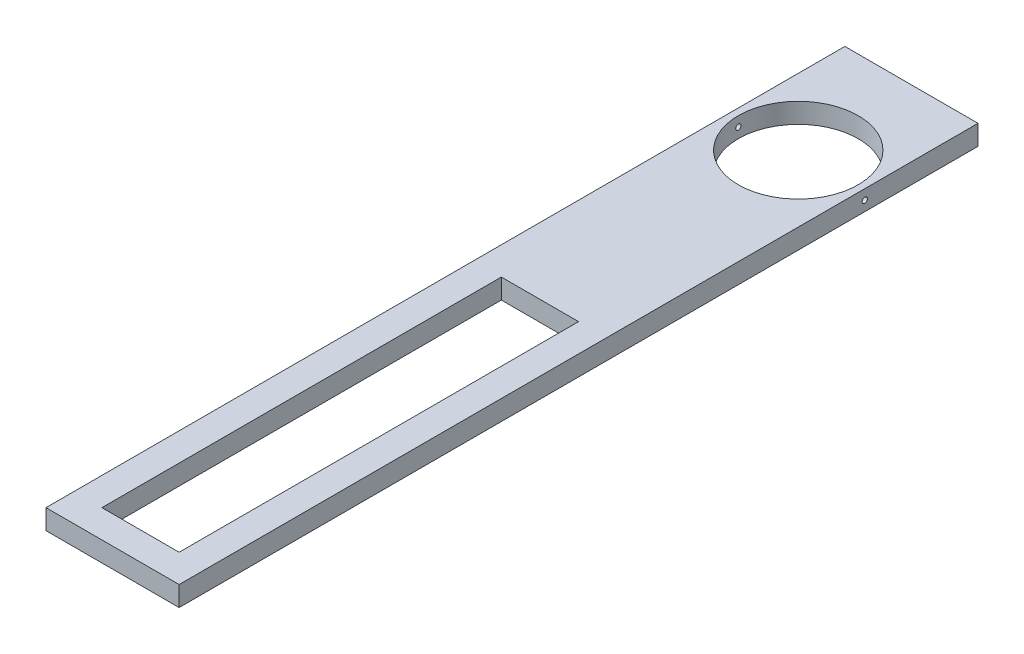
from build123d import *

# Parameters (mm, degrees)
SKETCH1_W               = 100
SKETCH1_H               = 600
BOSS_EXTRUDE2_DEPTH     = 15
SKETCH1_7_W             = 58
SKETCH1_7_H             = 300
CUT_EXTRUDE1_DEPTH      = 65
SKETCH1_8_R             = 45
CUT_EXTRUDE2_DEPTH      = 433.1643206
CUT_EXTRUDE4_DEPTH      = 441.195695118
CUT_EXTRUDE4_DEPTH_BACK = 441.195695118


with BuildPart() as part:
    # Sketch1 → Boss-Extrude2 (new body)
    with BuildSketch(Plane(origin=(0, 0, 0), x_dir=(1, 0, 0), z_dir=(0, 1, 0))):
        with Locations((0, 129)):
            Rectangle(SKETCH1_W, SKETCH1_H)
    extrude(amount=-BOSS_EXTRUDE2_DEPTH)

    # Sketch1<7> → Cut-Extrude1 (cut)
    with BuildSketch(Plane(origin=(0, 0, 0), x_dir=(1, 0, 0), z_dir=(0, 1, 0))):
        Rectangle(SKETCH1_7_W, SKETCH1_7_H)
    extrude(amount=-CUT_EXTRUDE1_DEPTH, mode=Mode.SUBTRACT)

    # Sketch1<8> → Cut-Extrude2 (cut, through all)
    with BuildSketch(Plane(origin=(0, 0, 0), x_dir=(1, 0, 0), z_dir=(0, 1, 0))):
        with Locations(Location((0, 344, 0), (0, 0, 270))):
            Circle(SKETCH1_8_R)
    extrude(amount=-CUT_EXTRUDE2_DEPTH, mode=Mode.SUBTRACT)

    # Sketch5 → Cut-Extrude4 (cut, two sides: drawn at the far end of the back side and taken through both)
    with BuildSketch(Plane(origin=(47.5, 0, 0), x_dir=(0, 0, -1), z_dir=(1, 0, 0)).offset(-CUT_EXTRUDE4_DEPTH_BACK)):
        with BuildLine():
            ThreePointArc((346, -7.5), (345.414213562, -6.085786438), (344, -5.5))
            Line((344, -5.5), (344, -9.5))
            ThreePointArc((344, -9.5), (345.414213562, -8.914213562), (346, -7.5))
        make_face()
        with BuildLine():
            Line((344, -9.5), (344, -5.5))
            ThreePointArc((344, -5.5), (342, -7.5), (344, -9.5))
        make_face()
    extrude(amount=CUT_EXTRUDE4_DEPTH + CUT_EXTRUDE4_DEPTH_BACK, mode=Mode.SUBTRACT)


solid = part.part
